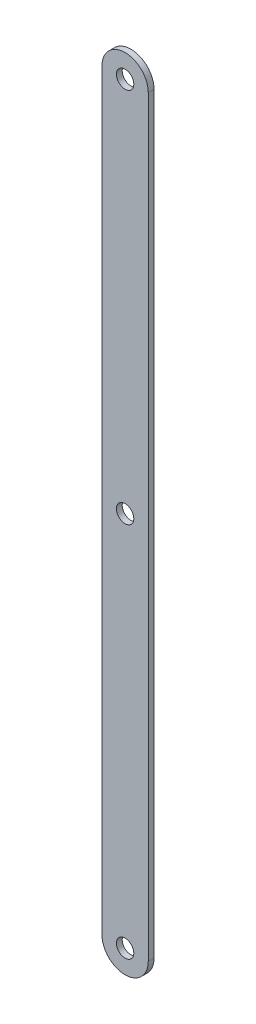
from build123d import *

# Parameters (mm, degrees)
SKETCH1_R           = 7.5
BOSS_EXTRUDE1_DEPTH = 5


with BuildPart() as part:
    # Sketch1 → Boss-Extrude1 (new body)
    with BuildSketch(Plane.XY):
        with BuildLine():
            Line((-20, 0), (-20, 650))
            ThreePointArc((-20, 650), (0, 670), (20, 650))
            Line((20, 650), (20, 0))
            ThreePointArc((20, 0), (0, -20), (-20, 0))
        make_face()
        with Locations((0, 650)):
            Circle(SKETCH1_R, mode=Mode.SUBTRACT)
        Circle(SKETCH1_R, mode=Mode.SUBTRACT)
        with Locations((0, 325)):
            Circle(SKETCH1_R, mode=Mode.SUBTRACT)
    extrude(amount=BOSS_EXTRUDE1_DEPTH)


solid = part.part
